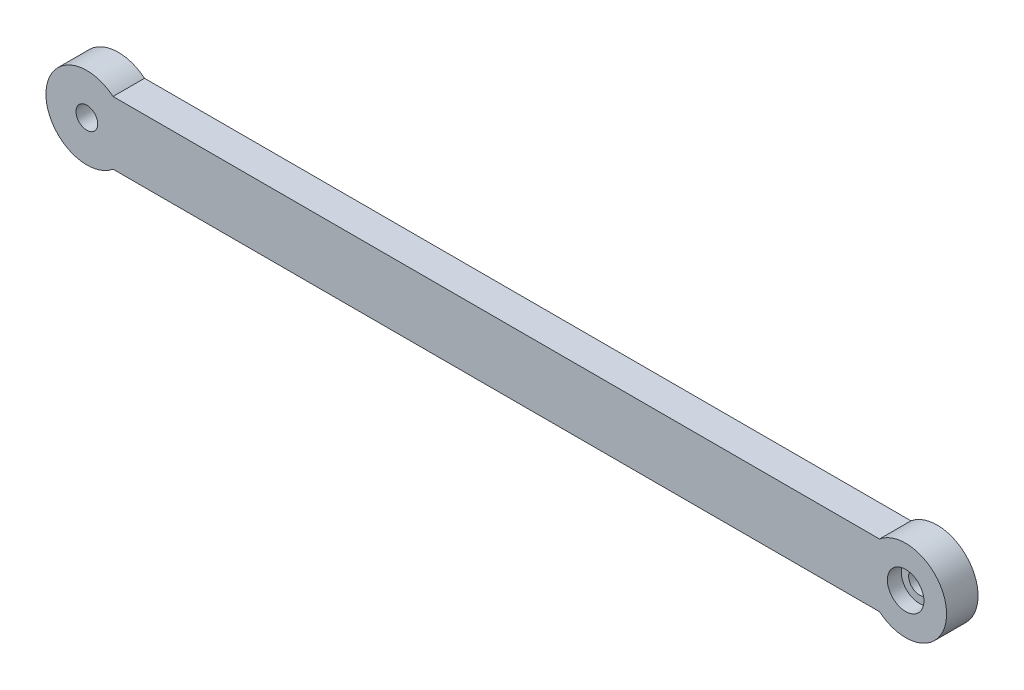
from build123d import *

# Parameters (mm, degrees)
BOSS_EXTRUDE1_START     = -3
SKETCH1_W               = 130
SKETCH1_H               = 10
BOSS_EXTRUDE1_DEPTH     = 5
BOSS_EXTRUDE2_START     = -3
SKETCH2_R               = 6.5
BOSS_EXTRUDE2_DEPTH     = 5
BOSS_EXTRUDE3_START     = -3
SKETCH3_R               = 6.5
BOSS_EXTRUDE3_DEPTH     = 5
CUT_EXTRUDE1_DEPTH      = 137.687600023
CUT_EXTRUDE1_DEPTH_BACK = 137.687600023
SKETCH4_R               = 1.725
CUT_EXTRUDE2_START      = -0.2
SKETCH5_R               = 2.9
CUT_EXTRUDE2_DEPTH      = 2.2


with BuildPart() as part:
    # Sketch1 → Boss-Extrude1 (new body)
    with BuildSketch(Plane.XY.offset(BOSS_EXTRUDE1_START)):
        with Locations((65, 0)):
            Rectangle(SKETCH1_W, SKETCH1_H)
    extrude(amount=BOSS_EXTRUDE1_DEPTH)

    # Sketch2 → Boss-Extrude2 (add)
    with BuildSketch(Plane.XY.offset(BOSS_EXTRUDE2_START)):
        Circle(SKETCH2_R)
    extrude(amount=BOSS_EXTRUDE2_DEPTH)

    # Sketch3 → Boss-Extrude3 (add)
    with BuildSketch(Plane.XY.offset(BOSS_EXTRUDE3_START)):
        with Locations((130, 0)):
            Circle(SKETCH3_R)
    extrude(amount=BOSS_EXTRUDE3_DEPTH)

    # Sketch4 → Cut-Extrude1 (cut, two sides: drawn at the far end of the back side and taken through both)
    with BuildSketch(Plane.XY.offset(-CUT_EXTRUDE1_DEPTH_BACK)):
        Circle(SKETCH4_R)
        with Locations((130, 0)):
            Circle(SKETCH4_R)
    extrude(amount=CUT_EXTRUDE1_DEPTH + CUT_EXTRUDE1_DEPTH_BACK, mode=Mode.SUBTRACT)

    # Sketch5 → Cut-Extrude2 (cut)
    with BuildSketch(Plane.XY.offset(CUT_EXTRUDE2_START)):
        with Locations((130, 0)):
            Circle(SKETCH5_R)
    extrude(amount=CUT_EXTRUDE2_DEPTH, mode=Mode.SUBTRACT)


solid = part.part
